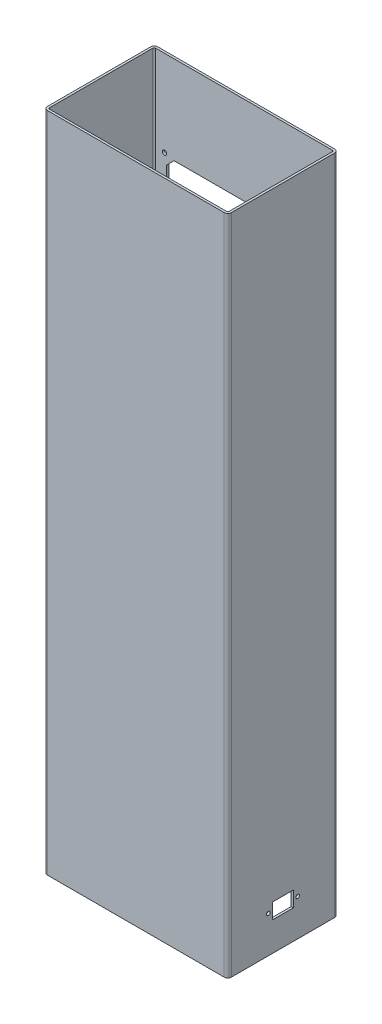
from build123d import *

# Parameters (mm, degrees)
ESQUISSE1_W             = 250
ESQUISSE1_H             = 150
BASE_EXTRUSION_DEPTH    = 900
CONG_2_R                = 5
COQUE1_T                = -3
ENL_V_MAT_EXTRU_2_DEPTH = 10
ESQUISSE4_R             = 3
ENL_V_MAT_EXTRU_3_DEPTH = 10
ESQUISSE6_R             = 2.5
ESQUISSE6_W             = 28
ESQUISSE6_H             = 21
ENL_V_MAT_EXTRU_4_DEPTH = 8


with BuildPart() as part:
    # Esquisse1 → Base-Extrusion (new body)
    with BuildSketch(Plane(origin=(0, 0, 0), x_dir=(1, 0, 0), z_dir=(0, 1, 0))):
        with Locations((125, 75)):
            Rectangle(ESQUISSE1_W, ESQUISSE1_H)
    extrude(amount=BASE_EXTRUSION_DEPTH)

    # Congé2
    cong_2_edges = [part.edges().sort_by_distance(p)[0] for p in [
        (0, 450, 0),
        (250, 450, 0),
        (250, 450, -150),
        (0, 450, -150),
    ]]
    fillet(cong_2_edges, radius=CONG_2_R)

    # Coque1
    coque1_openings = [part.faces().sort_by_distance(p)[0] for p in [
        (125, 0, -75),
        (125, 900, -75),
    ]]
    offset(amount=COQUE1_T, openings=coque1_openings, kind=Kind.INTERSECTION)

    # Esquisse3 → Enlèv. mat.-Extru.2 (cut)
    with BuildSketch(Plane(origin=(0, 0, -150), x_dir=(-1, 0, 0), z_dir=(0, 0, -1))):
        Polygon((-230, 770), (-220, 780), (-30, 780), (-20, 770), (-20, 460), (-30, 450), (-220, 450), (-230, 460), align=None)
    extrude(amount=-ENL_V_MAT_EXTRU_2_DEPTH, mode=Mode.SUBTRACT)

    # Esquisse4 → Enlèv. mat.-Extru.3 (cut)
    with BuildSketch(Plane(origin=(0, 0, -150), x_dir=(-1, 0, 0), z_dir=(0, 0, -1))):
        with Locations(Location((-17, 783, 0), (0, 0, 90))):
            Circle(ESQUISSE4_R)
        with Locations(Location((-17, 447, 0), (0, 0, 90))):
            Circle(ESQUISSE4_R)
        with Locations(Location((-233, 783, 0), (0, 0, 90))):
            Circle(ESQUISSE4_R)
        with Locations(Location((-233, 447, 0), (0, 0, 90))):
            Circle(ESQUISSE4_R)
    extrude(amount=-ENL_V_MAT_EXTRU_3_DEPTH, mode=Mode.SUBTRACT)

    # Esquisse6 → Enlèv. mat.-Extru.4 (cut)
    with BuildSketch(Plane(origin=(250, 0, 0), x_dir=(0, 0, -1), z_dir=(1, 0, 0))):
        with Locations(Location((95, 50, 0), (0, 0, 90))):
            Circle(ESQUISSE6_R)
        with Locations(Location((55, 50, 0), (0, 0, 90))):
            Circle(ESQUISSE6_R)
        with Locations((75, 50)):
            Rectangle(ESQUISSE6_W, ESQUISSE6_H)
    extrude(amount=-ENL_V_MAT_EXTRU_4_DEPTH, mode=Mode.SUBTRACT)


solid = part.part
